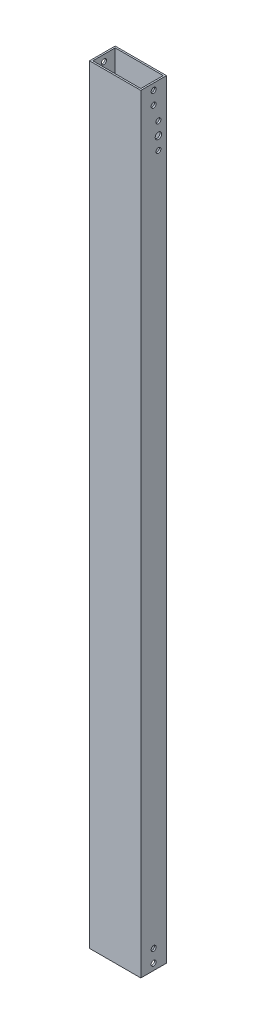
from build123d import *

# Parameters (mm, degrees)
SKETCH1_W               = 50.8
SKETCH1_H               = 762
BOSS_EXTRUDE1_DEPTH     = 12.7
SHELL1_T                = -1.5875
SKETCH3_R               = 2.4892
CUT_EXTRUDE1_DEPTH      = 383.056867495
CUT_EXTRUDE2_DEPTH      = 383.056867495
CUT_EXTRUDE2_DEPTH_BACK = 383.056867495
SKETCH4_R               = 3.175
SKETCH4_R_2             = 2.4892


with BuildPart() as part:
    # Sketch1 → Boss-Extrude1 (new, symmetric)
    with BuildSketch(Plane.XY):
        Rectangle(SKETCH1_W, SKETCH1_H)
    extrude(amount=BOSS_EXTRUDE1_DEPTH, both=True)

    # Shell1
    shell1_openings = [part.faces().sort_by_distance(p)[0] for p in [
        (0, -381, 0),
        (0, 381, 0),
    ]]
    offset(amount=SHELL1_T, openings=shell1_openings, kind=Kind.INTERSECTION)

    # Sketch3 → Cut-Extrude1 (cut, symmetric)
    with BuildSketch(Plane(origin=(0, 0, 0), x_dir=(0, 0, -1), z_dir=(1, 0, 0))):
        with Locations((0, -374.65)):
            Circle(SKETCH3_R)
        with Locations((0, -361.95)):
            Circle(SKETCH3_R)
    cut_extrude1 = extrude(amount=CUT_EXTRUDE1_DEPTH, both=True, mode=Mode.SUBTRACT)

    # Sketch4 → Cut-Extrude2 (cut, two sides: drawn at the far end of the back side and taken through both)
    with BuildSketch(Plane(origin=(0, 0, 0), x_dir=(0, 0, -1), z_dir=(1, 0, 0)).offset(-CUT_EXTRUDE2_DEPTH_BACK)):
        with Locations((4.7625, 333.375)):
            Circle(SKETCH4_R)
        with Locations((4.7625, 346.075)):
            Circle(SKETCH4_R_2)
        with Locations((4.7625, 320.675)):
            Circle(SKETCH4_R_2)
    extrude(amount=CUT_EXTRUDE2_DEPTH + CUT_EXTRUDE2_DEPTH_BACK, mode=Mode.SUBTRACT)

    # Mirror1: Cut-Extrude1 across plane
    add(cut_extrude1.mirror(Plane.ZX), mode=Mode.SUBTRACT)


solid = part.part
